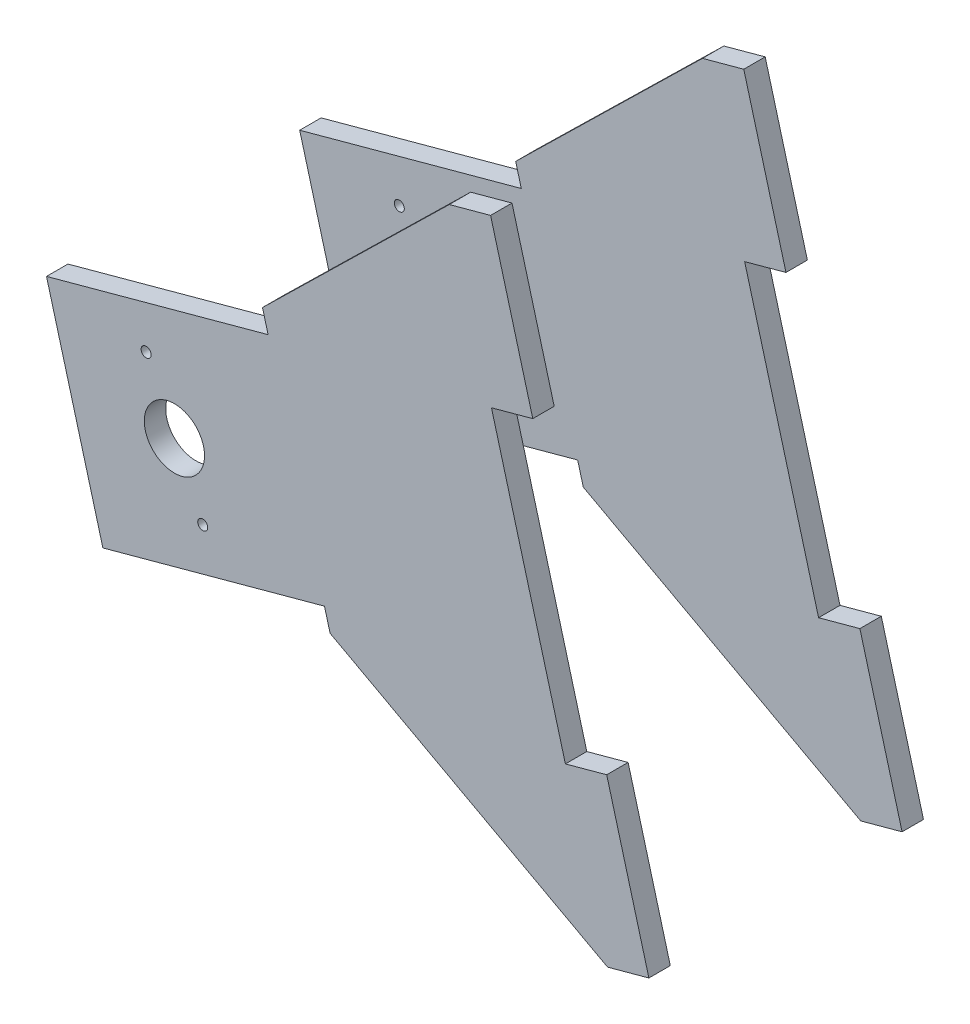
from build123d import *

# Parameters (mm, degrees)
BOSS_EXTRUDE1_START = -90
SKETCH1_R           = 14.2875
SKETCH1_R_2         = 2.38125
BOSS_EXTRUDE1_DEPTH = 10.16
BOSS_EXTRUDE2_START = -210.16
SKETCH1_2_R         = 14.2875
SKETCH1_2_R_2       = 2.38125
BOSS_EXTRUDE2_DEPTH = 10.16


with BuildPart() as part:
    # Sketch1 → Boss-Extrude1 (new body)
    with BuildSketch(Plane(origin=(2328.589821282, 466.462033654, -4.0040129), x_dir=(0.9648587645409115, 0.26276903259057416, 0), z_dir=(0, 0, 1)).offset(BOSS_EXTRUDE1_START)):
        Polygon((-2161.218921834, 236.892663878), (-2270.218921834, 236.892663878), (-2270.218921834, 135.08549762), (-2161.218921834, 135.08549762), (-2161.218921834, 124.92549762), (-2052.911580455, 21.456991118), (-2032.591580455, 21.456991118), (-2032.591580455, 97.656991118), (-2052.911580455, 97.656991118), (-2052.911580455, 231.177276923), (-2032.591580455, 231.177276923), (-2032.591580455, 307.377276923), (-2052.911580455, 307.377276923), (-2161.218921834, 247.052663878), align=None)
        with Locations((-2221.165130355, 185.989080749)):
            Circle(SKETCH1_R, mode=Mode.SUBTRACT)
        with Locations((-2226.570792022, 217.275520654)):
            Circle(SKETCH1_R_2, mode=Mode.SUBTRACT)
        with Locations((-2215.759468688, 154.702640844)):
            Circle(SKETCH1_R_2, mode=Mode.SUBTRACT)
    extrude(amount=BOSS_EXTRUDE1_DEPTH)


with BuildPart() as body_2:
    # Sketch1<2> → Boss-Extrude2 (new body)
    with BuildSketch(Plane(origin=(2328.589821282, 466.462033654, -4.0040129), x_dir=(0.9648587645409115, 0.26276903259057416, 0), z_dir=(0, 0, 1)).offset(BOSS_EXTRUDE2_START)):
        Polygon((-2161.218921834, 236.892663878), (-2270.218921834, 236.892663878), (-2270.218921834, 135.08549762), (-2161.218921834, 135.08549762), (-2161.218921834, 124.92549762), (-2052.911580455, 21.456991118), (-2032.591580455, 21.456991118), (-2032.591580455, 97.656991118), (-2052.911580455, 97.656991118), (-2052.911580455, 231.177276923), (-2032.591580455, 231.177276923), (-2032.591580455, 307.377276923), (-2052.911580455, 307.377276923), (-2161.218921834, 247.052663878), align=None)
        with Locations((-2221.165130355, 185.989080749)):
            Circle(SKETCH1_2_R, mode=Mode.SUBTRACT)
        with Locations((-2226.570792022, 217.275520654)):
            Circle(SKETCH1_2_R_2, mode=Mode.SUBTRACT)
        with Locations((-2215.759468688, 154.702640844)):
            Circle(SKETCH1_2_R_2, mode=Mode.SUBTRACT)
    extrude(amount=BOSS_EXTRUDE2_DEPTH)


solid = Compound([part.part, body_2.part])
